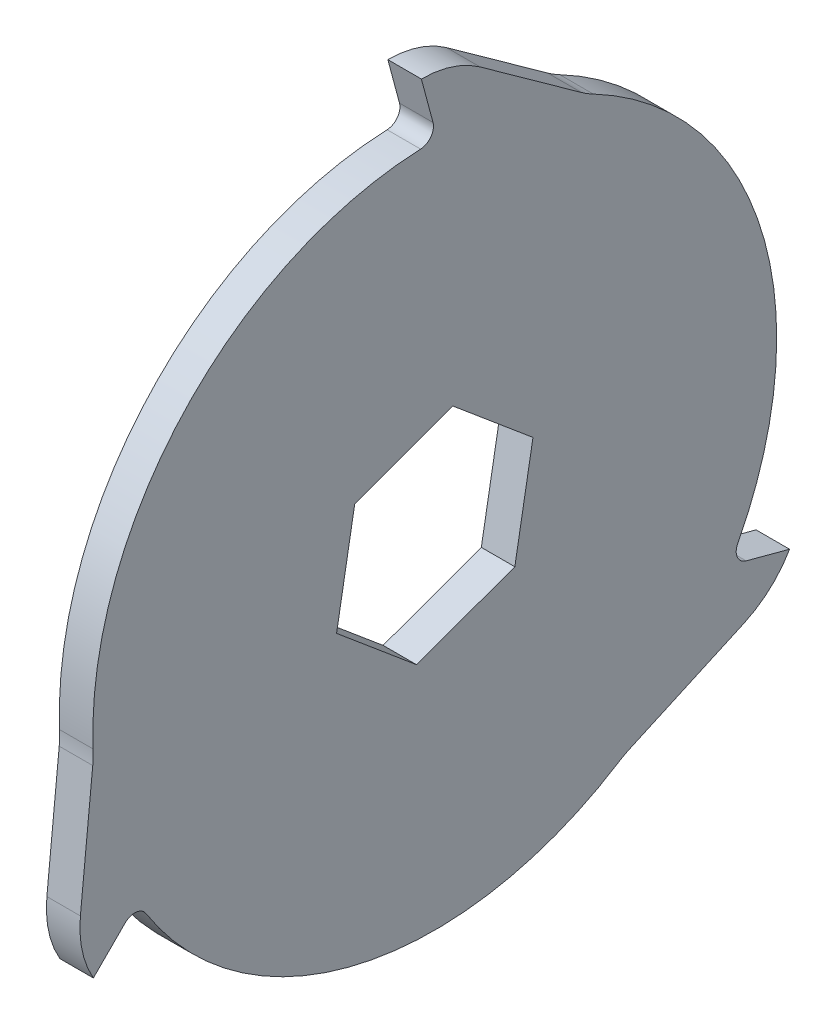
from build123d import *

# Parameters (mm, degrees)
SKETCH1_R         = 51
EXTRUDE1_DEPTH    = 2.5
EXTRUDE2_DEPTH    = 2.5
CIRPATTERN1_COUNT = 3


with BuildPart() as part:
    # Sketch1 → Extrude1 (new, symmetric)
    with BuildSketch(Plane(origin=(0, 0, 0), x_dir=(0, 0, -1), z_dir=(1, 0, 0))):
        Circle(SKETCH1_R)
        Polygon((14.648358264, 5.331566389), (2.706907197, 15.351633575), (-11.941451067, 10.020067186), (-14.648358264, -5.331566389), (-2.706907197, -15.351633575), (11.941451067, -10.020067186), align=None, mode=Mode.SUBTRACT)
    extrude(amount=EXTRUDE1_DEPTH, both=True)

    # Sketch2 → Extrude2 (add, symmetric)
    with BuildSketch(Plane(origin=(0, 0, 0), x_dir=(0, 0, -1), z_dir=(1, 0, 0))):
        with BuildLine():
            Line((-2, 59.956265369), (-0.262596806, 53.472188376))
            ThreePointArc((-0.262596806, 53.472188376), (-0.582870999, 51.770144067), (-2.111639083, 50.956265369))
            ThreePointArc((-2.111639083, 50.956265369), (11.148765219, 49.766505142), (23.649399595, 45.185239833))
            ThreePointArc((23.649399595, 45.185239833), (22.732801751, 45.706819988), (21.855117489, 46.291514612))
            Line((21.855117489, 46.291514612), (6.74998787, 57.139767012))
            ThreePointArc((6.74998787, 57.139767012), (2.596056753, 59.234789884), (-2, 59.956265369))
        make_face()
    extrude2 = extrude(amount=EXTRUDE2_DEPTH, both=True)

    # CirPattern1: Extrude2 ×3 about axis
    cirpattern1_axis = Axis((-5.5, 0, 0), (1, 0, 0))
    for i in range(1, CIRPATTERN1_COUNT):
        add(extrude2.rotate(cirpattern1_axis, i * 360 / CIRPATTERN1_COUNT))


solid = part.part
